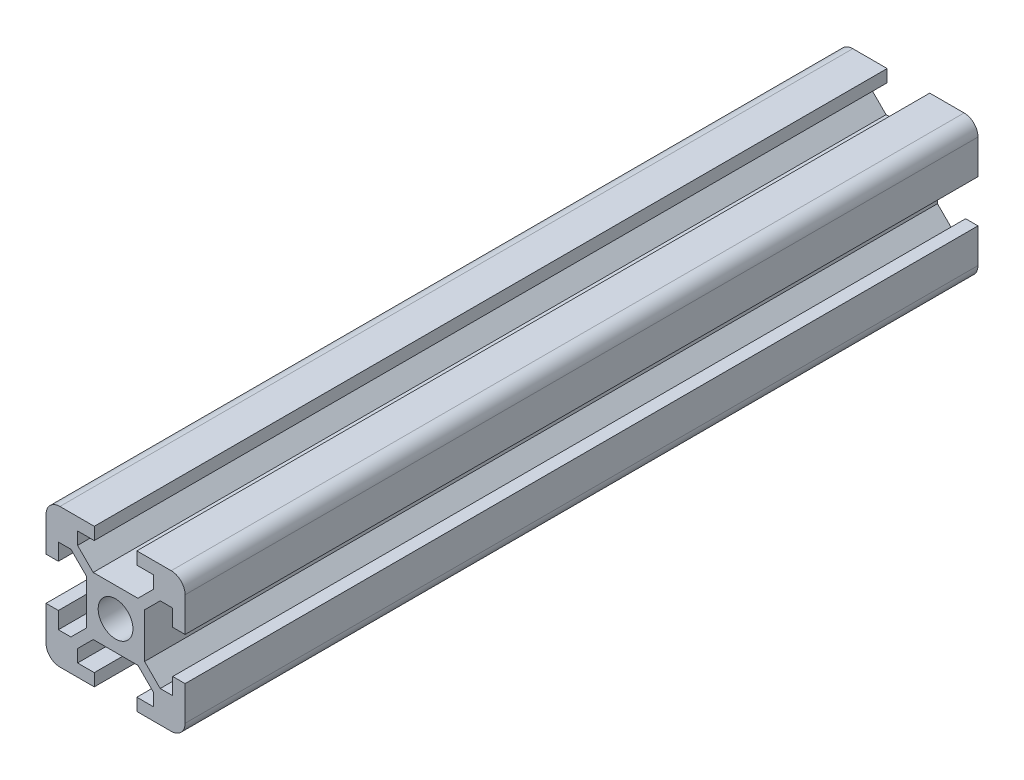
from build123d import *

# Parameters (mm, degrees)
SKETCH1_R           = 2.5
BOSS_EXTRUDE1_DEPTH = 114
FILLET1_R           = 2


with BuildPart() as part:
    # Sketch1 → Boss-Extrude1 (new body)
    with BuildSketch(Plane.XY):
        Polygon((-5.46, -6.42), (-3.215, -4.175), (3.215, -4.175), (5.46, -6.42), (5.46, -8.22), (3.06, -8.22), (3.06, -10), (10, -10), (10, -3.06), (8.22, -3.06), (8.22, -5.46), (6.42, -5.46), (4.175, -3.215), (4.175, 3.215), (6.42, 5.46), (8.22, 5.46), (8.22, 3.06), (10, 3.06), (10, 10), (3.06, 10), (3.06, 8.22), (5.46, 8.22), (5.46, 6.42), (3.215, 4.175), (-3.215, 4.175), (-5.46, 6.42), (-5.46, 8.22), (-3.06, 8.22), (-3.06, 10), (-10, 10), (-10, 3.06), (-8.22, 3.06), (-8.22, 5.46), (-6.42, 5.46), (-4.175, 3.215), (-4.175, -3.215), (-6.42, -5.46), (-8.22, -5.46), (-8.22, -3.06), (-10, -3.06), (-10, -10), (-3.06, -10), (-3.06, -8.22), (-5.46, -8.22), align=None)
        with Locations(Location((0, 0, 0), (0, 0, 180))):
            Circle(SKETCH1_R, mode=Mode.SUBTRACT)
    extrude(amount=BOSS_EXTRUDE1_DEPTH)

    # Fillet1
    fillet1_edges = [part.edges().sort_by_distance(p)[0] for p in [
        (10, -10, 57),
        (-10, -10, 57),
        (-10, 10, 57),
        (10, 10, 57),
    ]]
    fillet(fillet1_edges, radius=FILLET1_R)


solid = part.part
